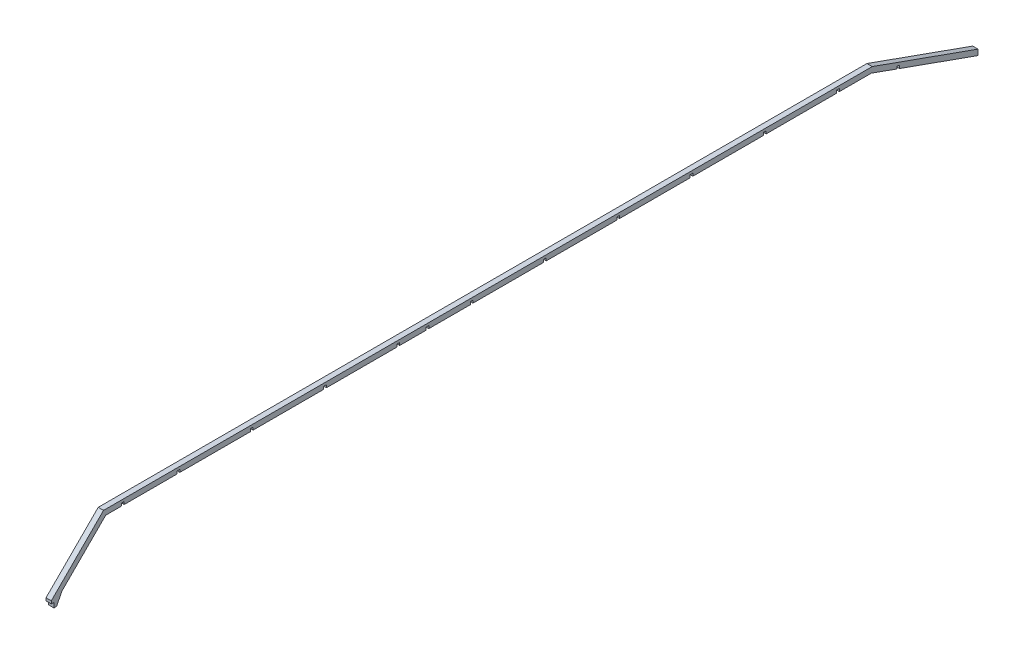
from build123d import *

# Parameters (mm, degrees)
EXTRUDE_3_DEPTH = 6


with BuildPart() as part:
    # Эскиз1 → Бобышка-Вытянуть3 (new body)
    with BuildSketch(Plane(origin=(0, 0, 0), x_dir=(0, 0, -1), z_dir=(1, 0, 0))):
        Polygon((-751.886625415, -19.142158624), (-733.960587786, -19.142158624), (-733.960587786, -16.142158624), (-730.960587786, -16.142158624), (-730.960587786, -19.142158624), (-670.960587786, -19.142158624), (-670.960587786, -16.142158624), (-667.960587786, -16.142158624), (-667.960587786, -19.142158624), (-587.960587786, -19.142158624), (-587.960587786, -16.142158624), (-584.960587786, -16.142158624), (-584.960587786, -19.142158624), (-504.960587786, -19.142158624), (-504.960587786, -16.142158624), (-501.960587786, -16.142158624), (-501.960587786, -19.142158624), (-421.960587786, -19.142158624), (-421.960587786, -16.142158624), (-418.960587786, -16.142158624), (-418.960587786, -19.142158624), (-388.960587786, -19.142158624), (-388.960587786, -16.142158624), (-385.960587786, -16.142158624), (-385.960587786, -19.142158624), (-338.960587786, -19.142158624), (-338.960587786, -16.142158624), (-335.960587786, -16.142158624), (-335.960587786, -19.142158624), (-255.960587786, -19.142158624), (-255.960587786, -16.142158624), (-252.960587786, -16.142158624), (-252.960587786, -19.142158624), (-172.960587786, -19.142158624), (-172.960587786, -16.142158624), (-169.960587786, -16.142158624), (-169.960587786, -19.142158624), (-89.960587786, -19.142158624), (-89.960587786, -16.142158624), (-86.960587786, -16.142158624), (-86.960587786, -19.142158624), (-6.960587786, -19.142158624), (-6.960587786, -16.142158624), (-3.960587786, -16.142158624), (-3.960587786, -19.142158624), (76.039412214, -19.142158624), (76.039412214, -16.142158624), (79.039412214, -16.142158624), (79.039412214, -19.142158624), (115.173374585, -19.142158624), (144.039412214, -29.449285501), (144.039412214, -26.449285501), (147.039412214, -27.520488312), (147.039412214, -30.520488312), (236.039412214, -62.299505021), (236.039412214, -55.928484549), (116.212450849, -13.142158624), (-754.371906789, -13.142158624), (-813.525123531, -72.295375365), (-813.525123531, -75.29065674), (-810.525123531, -75.29065674), (-810.525123531, -80.78065674), (-807.525123531, -80.78065674), (-801.525123531, -68.78065674), align=None)
    extrude(amount=EXTRUDE_3_DEPTH)


solid = part.part
